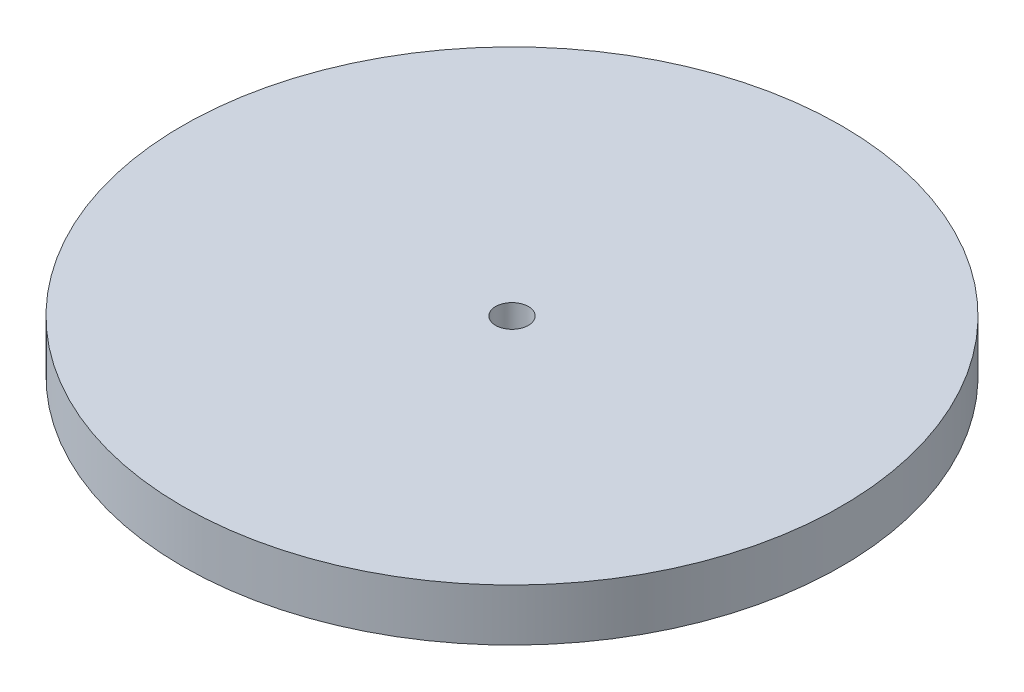
from build123d import *

# Parameters (mm, degrees)
SKETCH2_R           = 120.65
SKETCH2_R_2         = 6
BOSS_EXTRUDE1_DEPTH = 9.525


with BuildPart() as part:
    # Sketch2 → Boss-Extrude1 (new, symmetric)
    with BuildSketch(Plane(origin=(0, 0, 0), x_dir=(1, 0, 0), z_dir=(0, 1, 0))):
        with Locations(Location((0, 0, 0), (0, 0, 90))):
            Circle(SKETCH2_R)
        with Locations(Location((0, 0, 0), (0, 0, 90))):
            Circle(SKETCH2_R_2, mode=Mode.SUBTRACT)
    extrude(amount=BOSS_EXTRUDE1_DEPTH, both=True)


solid = part.part
